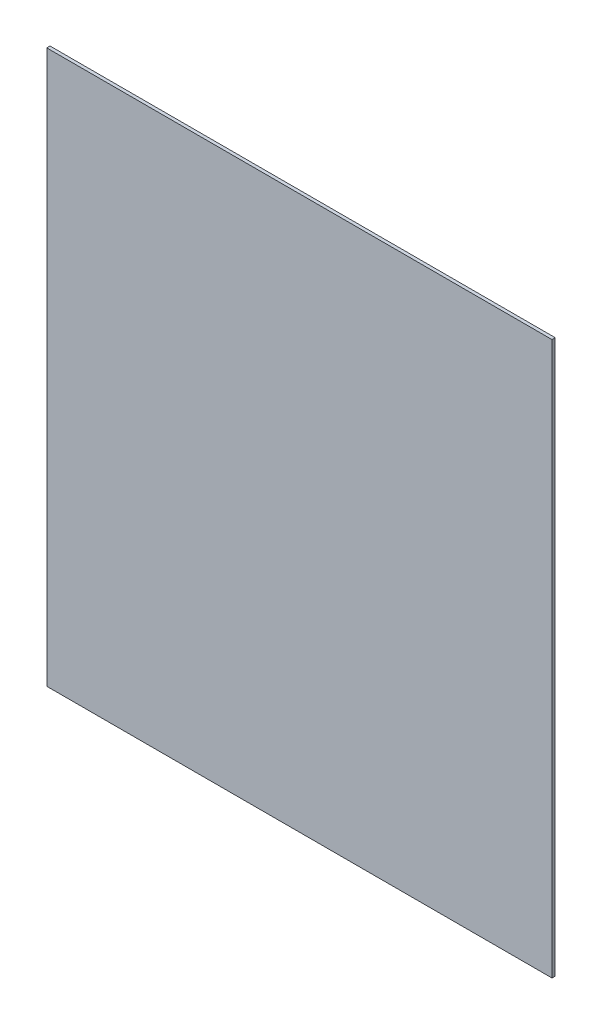
from build123d import *

# Parameters (mm, degrees)
SKICA1_W                = 466
SKICA1_H                = 510
P_IDAT_VYSUNUT_M1_DEPTH = 3


with BuildPart() as part:
    # Skica1 → Přidat vysunutím1 (new body)
    with BuildSketch(Plane.XY):
        Rectangle(SKICA1_W, SKICA1_H)
    extrude(amount=P_IDAT_VYSUNUT_M1_DEPTH)


solid = part.part
